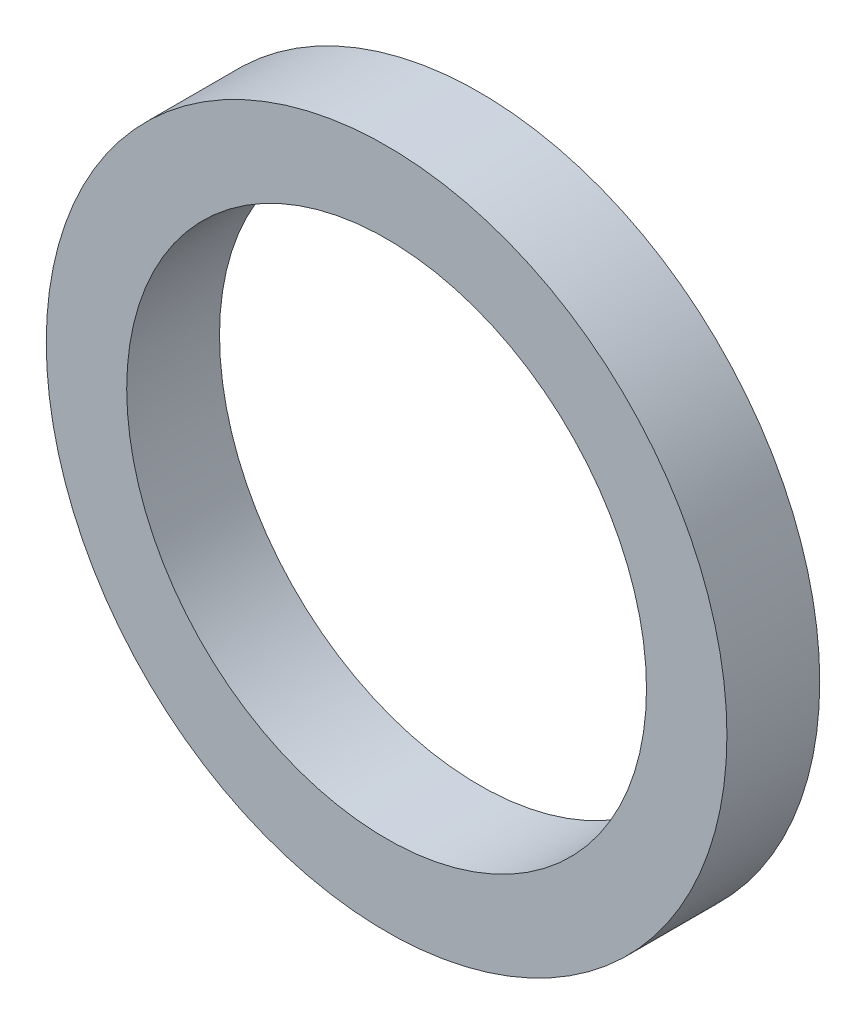
from build123d import *

# Parameters (mm, degrees)
BOSS_EXTRUDE1_START     = 10.5
SKETCH1_R               = 5.5
BOSS_EXTRUDE1_DEPTH     = 1.5
CUT_EXTRUDE1_DEPTH      = 15.300349646
CUT_EXTRUDE1_DEPTH_BACK = 15.300349646
SKETCH2_R               = 4.2


with BuildPart() as part:
    # Sketch1 → Boss-Extrude1 (new body)
    with BuildSketch(Plane.XY.offset(BOSS_EXTRUDE1_START)):
        Circle(SKETCH1_R)
    extrude(amount=BOSS_EXTRUDE1_DEPTH)

    # Sketch2 → Cut-Extrude1 (cut, two sides: drawn at the far end of the back side and taken through both)
    with BuildSketch(Plane.XY.offset(-CUT_EXTRUDE1_DEPTH_BACK)):
        with Locations(Location((0, 0, 0), (0, 0, 180))):
            Circle(SKETCH2_R)
    extrude(amount=CUT_EXTRUDE1_DEPTH + CUT_EXTRUDE1_DEPTH_BACK, mode=Mode.SUBTRACT)


solid = part.part
